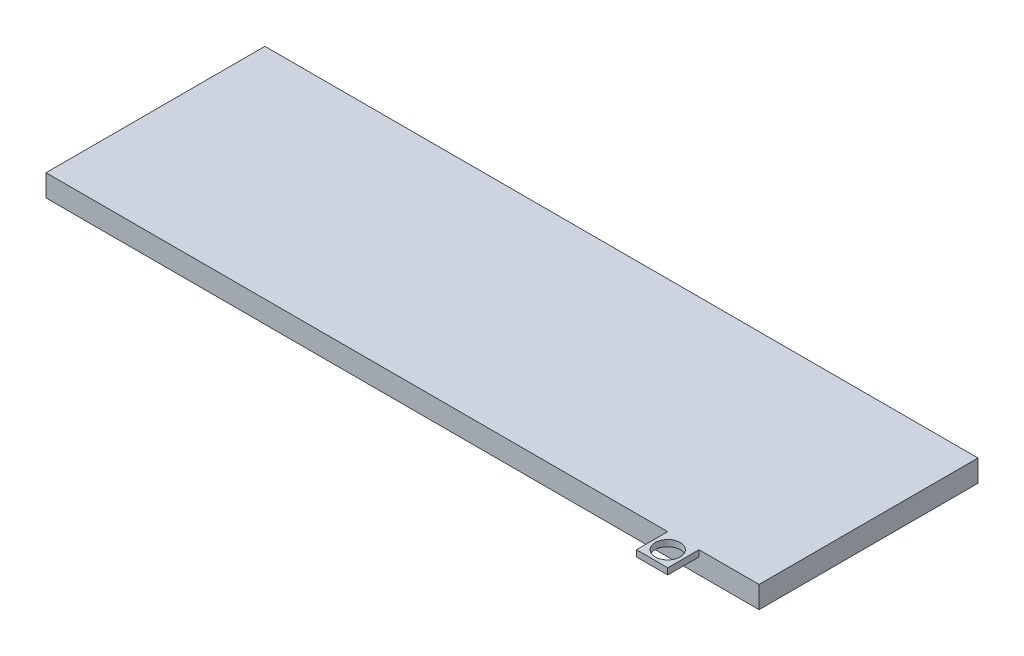
from build123d import *

# Parameters (mm, degrees)
BOSS_EXTRU_1_DEPTH = 70
ESQUISSE3_W        = 224
ESQUISSE3_H        = 5
BOSS_EXTRU_2_DEPTH = 2
ESQUISSE5_W        = 10
ESQUISSE5_H        = 10
ESQUISSE5_R        = 4
BOSS_EXTRU_3_DEPTH = 2
ESQUISSE6_W        = 224
ESQUISSE6_H        = 5
BOSS_EXTRU_4_DEPTH = 2


with BuildPart() as part:
    # Esquisse1 → Boss.-Extru.1 (new body)
    with BuildSketch(Plane.XY):
        Polygon((-115.072635135, 3.126470588), (-115.072635135, -3.873529412), (-113.072635135, -3.873529412), (-113.072635135, 1.126470588), (110.927364865, 1.126470588), (110.927364865, -3.873529412), (112.927364865, -3.873529412), (112.927364865, 3.126470588), align=None)
    extrude(amount=BOSS_EXTRU_1_DEPTH)

    # Esquisse3 → Boss.-Extru.2 (add)
    with BuildSketch(Plane(origin=(0, 0, 0), x_dir=(-1, 0, 0), z_dir=(0, 0, -1))):
        with Locations((1.072635135, -1.373529412)):
            Rectangle(ESQUISSE3_W, ESQUISSE3_H)
    extrude(amount=-BOSS_EXTRU_2_DEPTH)

    # Esquisse5 → Boss.-Extru.3 (add, through all)
    with BuildSketch(Plane.XZ.offset(-1.126470588)):
        with Locations((88.718220762, 75)):
            Rectangle(ESQUISSE5_W, ESQUISSE5_H)
        with Locations(Location((88.718220762, 75, 0), (0, 0, 270))):
            Circle(ESQUISSE5_R, mode=Mode.SUBTRACT)
    extrude(amount=-BOSS_EXTRU_3_DEPTH)

    # Esquisse6 → Boss.-Extru.4 (add)
    with BuildSketch(Plane.XY.offset(70)):
        with Locations((-1.072635135, -1.373529412)):
            Rectangle(ESQUISSE6_W, ESQUISSE6_H)
    extrude(amount=-BOSS_EXTRU_4_DEPTH)


solid = part.part
